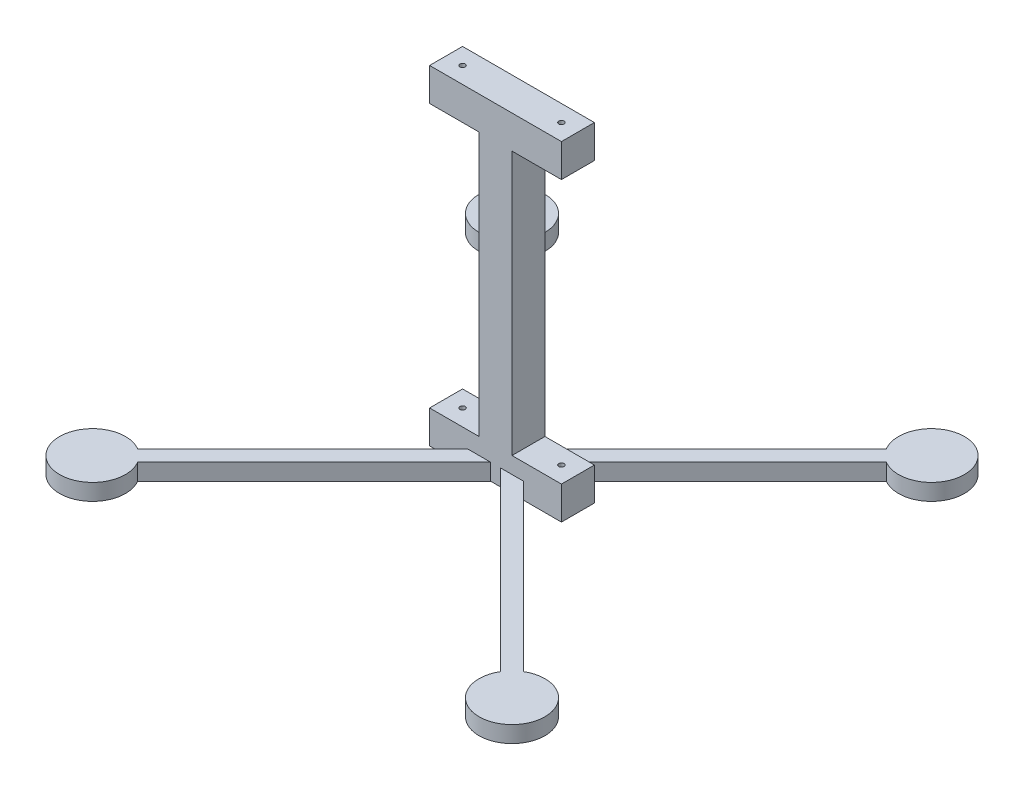
from build123d import *

# Parameters (mm, degrees)
EXTRUDE_1_DEPTH          = 5
EXTRUDE_2_DEPTH          = 5
PATTERN_CIRCULAR_1_COUNT = 4
SKETCH_3_R               = 10
EXTRUDE_3_DEPTH          = 5
PATTERN_CIRCULAR_2_COUNT = 4
SKETCH_4_R               = 0.8
CUT_EXTRUDE_1_DEPTH      = 219


with BuildPart() as part:
    # 草图1 → 凸台-拉伸1 (new, symmetric)
    with BuildSketch(Plane.XY):
        Polygon((-20, 10), (20, 10), (20, 0), (5, 0), (5, -80), (20, -80), (20, -90), (-20, -90), (-20, -80), (-5, -80), (-5, 0), (-20, 0), align=None)
    extrude(amount=EXTRUDE_1_DEPTH, both=True)

    # 草图2 → 凸台-拉伸2 (add)
    with BuildSketch(Plane.XZ.offset(90)):
        Polygon((65.40737726, 61.871843354), (61.871843354, 65.40737726), (-1.767766953, 1.767766953), (1.767766953, -1.767766953), align=None)
    extrude_2 = extrude(amount=-EXTRUDE_2_DEPTH)

    # 阵列(圆周)1: 凸台-拉伸2 ×4 about axis
    pattern_circular_1_axis = Axis((0, 0, 0), (0, 1, 0))
    for i in range(1, PATTERN_CIRCULAR_1_COUNT):
        add(extrude_2.rotate(pattern_circular_1_axis, i * 360 / PATTERN_CIRCULAR_1_COUNT))

    # 草图3 → 凸台-拉伸3 (add)
    with BuildSketch(Plane(origin=(0, -85, 0), x_dir=(1, 0, 0), z_dir=(0, 1, 0))):
        with Locations((63.639610307, 63.639610307)):
            Circle(SKETCH_3_R)
    extrude_3 = extrude(amount=-EXTRUDE_3_DEPTH)

    # 阵列(圆周)2: 凸台-拉伸3 ×4 about axis
    pattern_circular_2_axis = Axis((0, 0, 0), (0, 1, 0))
    for i in range(1, PATTERN_CIRCULAR_2_COUNT):
        add(extrude_3.rotate(pattern_circular_2_axis, i * 360 / PATTERN_CIRCULAR_2_COUNT))

    # 草图4 → 切除-拉伸1 (cut)
    with BuildSketch(Plane(origin=(0, 10, 0), x_dir=(1, 0, 0), z_dir=(0, 1, 0))):
        with Locations(Location((15, 0, 0), (0, 0, 180))):
            Circle(SKETCH_4_R)
        with Locations(Location((-15, 0, 0), (0, 0, 270))):
            Circle(SKETCH_4_R)
    extrude(amount=-CUT_EXTRUDE_1_DEPTH, mode=Mode.SUBTRACT)


solid = part.part
